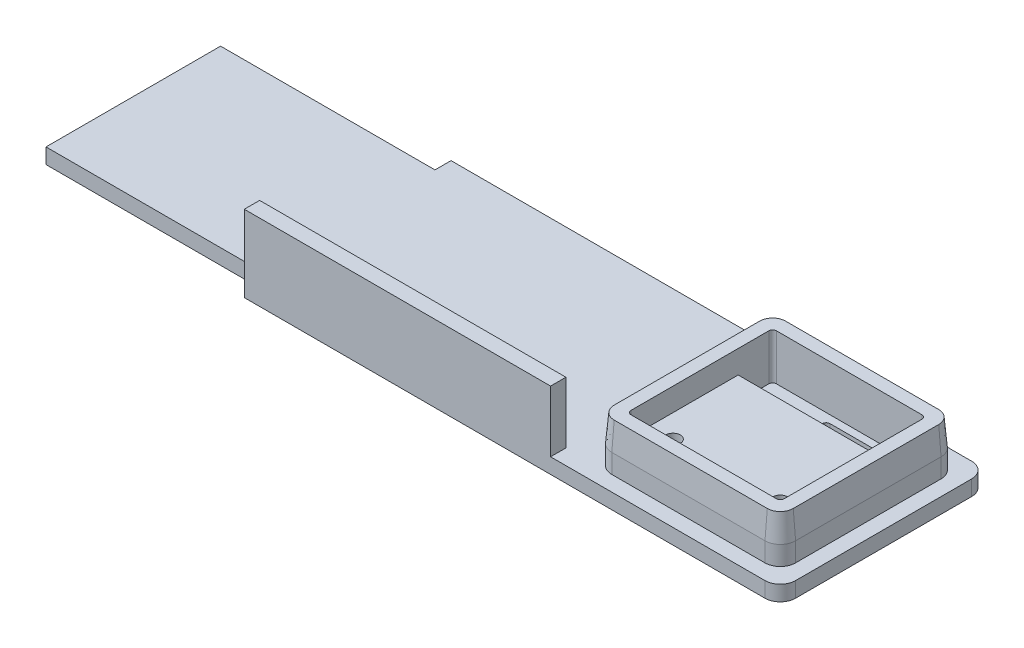
from build123d import *
from OCP.BRepFilletAPI import BRepFilletAPI_MakeChamfer

# Parameters (mm, degrees)
SKETCH1_W           = 28
SKETCH1_H           = 27
BOSS_EXTRUDE1_DEPTH = 2
SKETCH2_W           = 10
SKETCH2_H           = 2.5
CUT_EXTRUDE1_DEPTH  = 2
SKETCH3_W           = 20
SKETCH3_H           = 14.5
BOSS_EXTRUDE2_DEPTH = 3
SKETCH4_W           = 24
SKETCH4_H           = 23
SKETCH4_W_2         = 20
SKETCH4_H_2         = 19
BOSS_EXTRUDE3_DEPTH = 6
SKETCH5_R           = 0.95
CUT_EXTRUDE2_DEPTH  = 3.2
FILLET3_R           = 2
FILLET2_R           = 0.5
SKETCH6_W           = 27
SKETCH6_H           = 2
BOSS_EXTRUDE4_DEPTH = 70
CHAMFER1_SIZE       = 3.5
CHAMFER1_SIZE2      = 0.306210322
SKETCH7_W           = 28
SKETCH7_H           = 2.1
CUT_EXTRUDE3_DEPTH  = 86.289213855
SKETCH8_W           = 40
SKETCH8_H           = 8
BOSS_EXTRUDE5_DEPTH = 2


with BuildPart() as part:
    # Sketch1 → Boss-Extrude1 (new body)
    with BuildSketch(Plane(origin=(0, 0, 0), x_dir=(1, 0, 0), z_dir=(0, 1, 0))):
        Rectangle(SKETCH1_W, SKETCH1_H)
    extrude(amount=BOSS_EXTRUDE1_DEPTH)

    # Sketch2 → Cut-Extrude1 (cut)
    with BuildSketch(Plane(origin=(0, 2, 0), x_dir=(1, 0, 0), z_dir=(0, 1, 0))):
        with Locations((3, 7.25)):
            Rectangle(SKETCH2_W, SKETCH2_H)
    extrude(amount=-CUT_EXTRUDE1_DEPTH, mode=Mode.SUBTRACT)

    # Sketch3 → Boss-Extrude2 (add)
    with BuildSketch(Plane(origin=(0, 2, 0), x_dir=(1, 0, 0), z_dir=(0, 1, 0))):
        with Locations((0, -2.25)):
            Rectangle(SKETCH3_W, SKETCH3_H)
    extrude(amount=BOSS_EXTRUDE2_DEPTH)

    # Sketch4 → Boss-Extrude3 (add)
    with BuildSketch(Plane(origin=(0, 2, 0), x_dir=(1, 0, 0), z_dir=(0, 1, 0))):
        Rectangle(SKETCH4_W, SKETCH4_H)
        Rectangle(SKETCH4_W_2, SKETCH4_H_2, mode=Mode.SUBTRACT)
    extrude(amount=BOSS_EXTRUDE3_DEPTH)

    # Sketch5 → Cut-Extrude2 (cut)
    with BuildSketch(Plane(origin=(0, 5, 0), x_dir=(1, 0, 0), z_dir=(0, 1, 0))):
        with Locations(Location((-7, -6.5, 0), (0, 0, 270))):
            Circle(SKETCH5_R)
        with Locations(Location((7, -6.5, 0), (0, 0, 90))):
            Circle(SKETCH5_R)
    extrude(amount=-CUT_EXTRUDE2_DEPTH, mode=Mode.SUBTRACT)

    # Fillet3
    fillet3_edges = [part.edges().sort_by_distance(p)[0] for p in [
        (12, 5, -11.5),
        (-12, 5, -11.5),
        (-12, 5, 11.5),
        (12, 5, 11.5),
        (14, 1, 13.5),
        (14, 1, -13.5),
    ]]
    fillet(fillet3_edges, radius=FILLET3_R)

    # Fillet2
    fillet2_edges = [part.edges().sort_by_distance(p)[0] for p in [
        (-2, 1, -8.5),
        (-2, 1, -6),
        (8, 1, -6),
        (8, 1, -8.5),
        (10, 5, -9.5),
        (-10, 6.5, 9.5),
        (10, 6.5, 9.5),
        (-10, 5, -9.5),
    ]]
    fillet(fillet2_edges, radius=FILLET2_R)

    # Sketch6 → Boss-Extrude4 (add)
    with BuildSketch(Plane.ZY.offset(14)):
        with Locations((0, 1)):
            Rectangle(SKETCH6_W, SKETCH6_H)
    extrude(amount=BOSS_EXTRUDE4_DEPTH)

    # Chamfer1: one chamfer whose edges measure the first distance from different faces: ONE call of the kernel's chamfer builder (chamfer() names one face for all edges)
    chamfer1_edges_1 = [part.edges().sort_by_distance(p)[0] for p in [
        (0, 8, -11.5),
    ]]
    chamfer1_side_1 = [part.faces().sort_by_distance(p)[0] for p in [
        (0, 5, -11.5),
    ]]
    chamfer1_edges_2 = [part.edges().sort_by_distance(p)[0] for p in [
        (12, 8, 0),
    ]]
    chamfer1_side_2 = [part.faces().sort_by_distance(p)[0] for p in [
        (12, 5, 0),
    ]]
    chamfer1_edges_3 = [part.edges().sort_by_distance(p)[0] for p in [
        (-12, 8, 0),
    ]]
    chamfer1_side_3 = [part.faces().sort_by_distance(p)[0] for p in [
        (-12, 5, 0),
    ]]
    chamfer1_edges_4 = [part.edges().sort_by_distance(p)[0] for p in [
        (0, 8, 11.5),
    ]]
    chamfer1_side_4 = [part.faces().sort_by_distance(p)[0] for p in [
        (0, 5, 11.5),
    ]]
    chamfer1_edges_5 = [part.edges().sort_by_distance(p)[0] for p in [
        (-11.414213562, 8, -10.914213562),
    ]]
    chamfer1_side_5 = [part.faces().sort_by_distance(p)[0] for p in [
        (-11.414213562, 5, -10.914213562),
    ]]
    chamfer1_edges_6 = [part.edges().sort_by_distance(p)[0] for p in [
        (-11.414213562, 8, 10.914213562),
    ]]
    chamfer1_side_6 = [part.faces().sort_by_distance(p)[0] for p in [
        (-11.414213562, 5, 10.914213562),
    ]]
    chamfer1_edges_7 = [part.edges().sort_by_distance(p)[0] for p in [
        (11.414213562, 8, 10.914213562),
    ]]
    chamfer1_side_7 = [part.faces().sort_by_distance(p)[0] for p in [
        (11.414213562, 5, 10.914213562),
    ]]
    chamfer1_edges_8 = [part.edges().sort_by_distance(p)[0] for p in [
        (11.414213562, 8, -10.914213562),
    ]]
    chamfer1_side_8 = [part.faces().sort_by_distance(p)[0] for p in [
        (11.414213562, 5, -10.914213562),
    ]]
    chamfer1 = BRepFilletAPI_MakeChamfer(part.part.solid().wrapped)
    for e in chamfer1_edges_1:
        chamfer1.Add(CHAMFER1_SIZE, CHAMFER1_SIZE2, e.wrapped, chamfer1_side_1[0].wrapped)  # the first distance lies on this face
    for e in chamfer1_edges_2:
        chamfer1.Add(CHAMFER1_SIZE, CHAMFER1_SIZE2, e.wrapped, chamfer1_side_2[0].wrapped)  # the first distance lies on this face
    for e in chamfer1_edges_3:
        chamfer1.Add(CHAMFER1_SIZE, CHAMFER1_SIZE2, e.wrapped, chamfer1_side_3[0].wrapped)  # the first distance lies on this face
    for e in chamfer1_edges_4:
        chamfer1.Add(CHAMFER1_SIZE, CHAMFER1_SIZE2, e.wrapped, chamfer1_side_4[0].wrapped)  # the first distance lies on this face
    for e in chamfer1_edges_5:
        chamfer1.Add(CHAMFER1_SIZE, CHAMFER1_SIZE2, e.wrapped, chamfer1_side_5[0].wrapped)  # the first distance lies on this face
    for e in chamfer1_edges_6:
        chamfer1.Add(CHAMFER1_SIZE, CHAMFER1_SIZE2, e.wrapped, chamfer1_side_6[0].wrapped)  # the first distance lies on this face
    for e in chamfer1_edges_7:
        chamfer1.Add(CHAMFER1_SIZE, CHAMFER1_SIZE2, e.wrapped, chamfer1_side_7[0].wrapped)  # the first distance lies on this face
    for e in chamfer1_edges_8:
        chamfer1.Add(CHAMFER1_SIZE, CHAMFER1_SIZE2, e.wrapped, chamfer1_side_8[0].wrapped)  # the first distance lies on this face
    add(Compound.cast(chamfer1.Shape()), mode=Mode.REPLACE)

    # Sketch7 → Cut-Extrude3 (cut, through all)
    with BuildSketch(Plane(origin=(0, 2, 0), x_dir=(1, 0, 0), z_dir=(0, 1, 0))):
        with Locations((-70, 12.45)):
            Rectangle(SKETCH7_W, SKETCH7_H)
    cut_extrude3 = extrude(amount=-CUT_EXTRUDE3_DEPTH, mode=Mode.SUBTRACT)

    # Mirror1: Cut-Extrude3 across plane
    add(cut_extrude3.mirror(Plane.XY), mode=Mode.SUBTRACT)

    # Sketch8 → Boss-Extrude5 (add)
    with BuildSketch(Plane.XY.offset(13.5)):
        with Locations((-36, 6)):
            Rectangle(SKETCH8_W, SKETCH8_H)
    extrude(amount=-BOSS_EXTRUDE5_DEPTH)


solid = part.part
